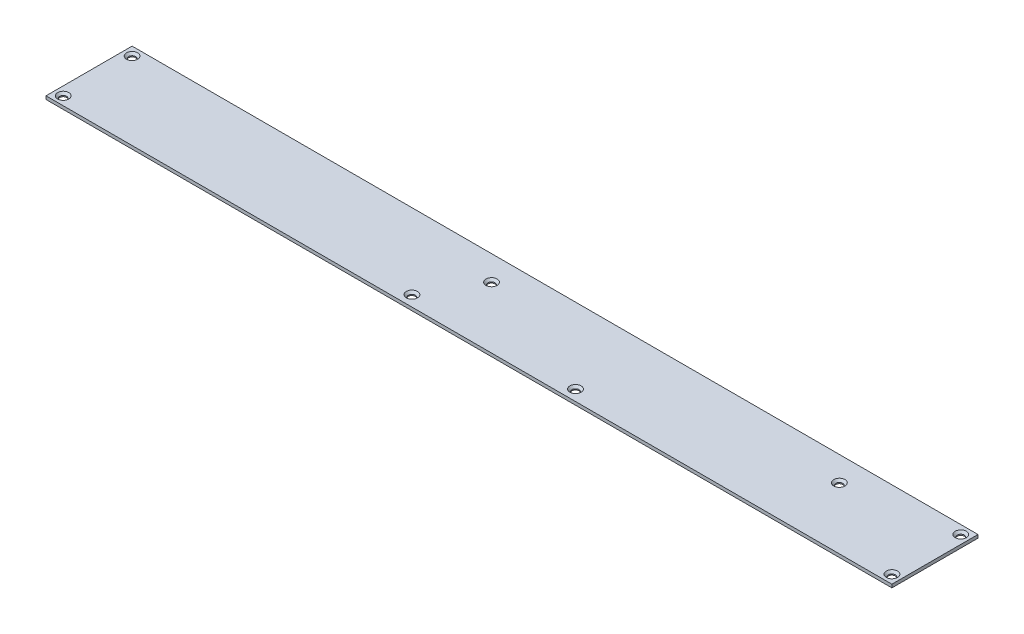
from build123d import *

# Parameters (mm, degrees)
SKIZZE1_W                       = 393
SKIZZE1_H                       = 40
AUFSATZ_LINEAR_AUSTRAGEN1_DEPTH = 1.5
SKIZZE2_R                       = 1.6
SCHNITT_LINEAR_AUSTRAGEN1_DEPTH = 198.520884972
FASE1_SIZE                      = 1


with BuildPart() as part:
    # Skizze1 → Aufsatz-Linear austragen1 (new body)
    with BuildSketch(Plane(origin=(0, 0, 0), x_dir=(1, 0, 0), z_dir=(0, 1, 0))):
        Rectangle(SKIZZE1_W, SKIZZE1_H)
    extrude(amount=AUFSATZ_LINEAR_AUSTRAGEN1_DEPTH)

    # Skizze2 → Schnitt-Linear austragen1 (cut, through all)
    with BuildSketch(Plane(origin=(0, 1.5, 0), x_dir=(1, 0, 0), z_dir=(0, 1, 0))):
        with Locations(Location((-192.5, 16, 0), (0, 0, 270))):
            Circle(SKIZZE2_R)
        with Locations(Location((-192.5, -16, 0), (0, 0, 270))):
            Circle(SKIZZE2_R)
        with Locations(Location((192.5, -16, 0), (0, 0, 270))):
            Circle(SKIZZE2_R)
        with Locations(Location((192.5, 16, 0), (0, 0, 270))):
            Circle(SKIZZE2_R)
        with Locations(Location((44.5, -15, 0), (0, 0, 270))):
            Circle(SKIZZE2_R)
        with BuildLine():
            ThreePointArc((-16.400011, 8.5), (-16.86864015, 9.63137085), (-18.000011, 10.1))
            Line((-18.000011, 10.1), (-18.000011, 6.9))
            ThreePointArc((-18.000011, 6.9), (-16.86864015, 7.36862915), (-16.400011, 8.5))
        make_face()
        with BuildLine():
            Line((-18.000011, 6.9), (-18.000011, 10.1))
            ThreePointArc((-18.000011, 10.1), (-19.600011, 8.5), (-18.000011, 6.9))
        make_face()
        with BuildLine():
            ThreePointArc((145.099964038, 8.589999773), (144.631340773, 9.721364737), (143.499980683, 10.189999773))
            Line((143.499980683, 10.189999773), (143.499947392, 6.989999773))
            ThreePointArc((143.499947392, 6.989999773), (144.631329002, 7.458623038), (145.099964038, 8.589999773))
        make_face()
        with BuildLine():
            Line((143.499947392, 6.989999773), (143.499980683, 10.189999773))
            ThreePointArc((143.499980683, 10.189999773), (141.899964038, 8.590016418), (143.499947392, 6.989999773))
        make_face()
        with Locations(Location((-31.5, -15, 0), (0, 0, 270))):
            Circle(SKIZZE2_R)
    extrude(amount=-SCHNITT_LINEAR_AUSTRAGEN1_DEPTH, mode=Mode.SUBTRACT)

    # Fase1
    fase1_edges = [part.edges().sort_by_distance(p)[0] for p in [
        (44.5, 1.5, 13.4),
        (192.5, 1.5, -17.6),
        (192.5, 1.5, 14.4),
        (-192.5, 1.5, 14.4),
        (-18.000011, 1.5, -10.1),
        (143.499947392, 1.5, -6.989999773),
        (-31.5, 1.5, 13.4),
        (-192.5, 1.5, -17.6),
    ]]
    chamfer(fase1_edges, length=FASE1_SIZE)


solid = part.part
